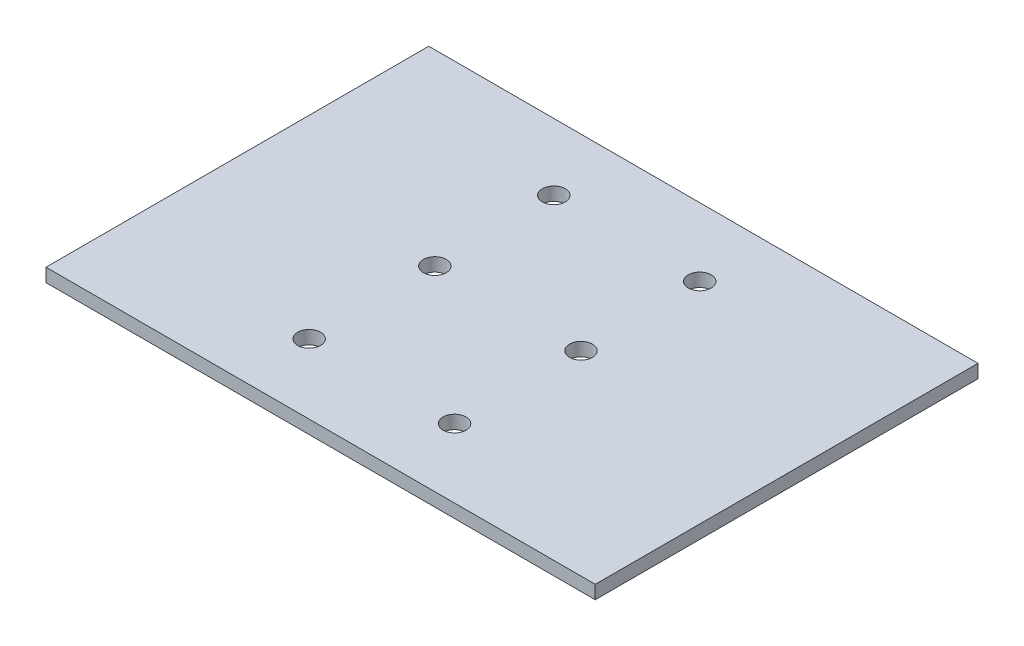
from build123d import *

# Parameters (mm, degrees)
SKETCH1_W             = 143.5
SKETCH1_H             = 100
BOSS_EXTRUDE1_DEPTH   = 3.5
F_6_0MM_DOWEL_HOLE1_D = 6
F_6_0MM_DOWEL_HOLE2_D = 6
F_6_0MM_DOWEL_HOLE3_D = 6
F_6_0MM_DOWEL_HOLE4_D = 6
F_6_0MM_DOWEL_HOLE5_D = 6
F_6_0MM_DOWEL_HOLE6_D = 6


with BuildPart() as part:
    # Sketch1 → Boss-Extrude1 (new body)
    with BuildSketch(Plane(origin=(0, 0, 0), x_dir=(1, 0, 0), z_dir=(0, 1, 0))):
        with Locations((44.896177875, -22.027268619)):
            Rectangle(SKETCH1_W, SKETCH1_H)
    extrude(amount=BOSS_EXTRUDE1_DEPTH)

    # Ø6.0mm Dowel Hole1 (through all)
    with Locations(Plane(origin=(237.217905301, 3.5, -102.05218535), x_dir=(0, 0, 1), z_dir=(0, 1, 0))):
        with Locations((156.087532559, -175.318700205)):
            Hole(F_6_0MM_DOWEL_HOLE1_D / 2)

    # Ø6.0mm Dowel Hole2 (through all)
    with Locations(Plane(origin=(237.217905301, 3.5, -102.05218535), x_dir=(0, 0, 1), z_dir=(0, 1, 0))):
        with Locations((123.097877986, -175.280990501)):
            Hole(F_6_0MM_DOWEL_HOLE2_D / 2)

    # Ø6.0mm Dowel Hole3 (through all)
    with Locations(Plane(origin=(237.217905301, 3.5, -102.05218535), x_dir=(0, 0, 1), z_dir=(0, 1, 0))):
        with Locations((123.026211567, -213.535463753)):
            Hole(F_6_0MM_DOWEL_HOLE3_D / 2)

    # Ø6.0mm Dowel Hole4 (through all)
    with Locations(Plane(origin=(237.217905301, 3.5, -102.05218535), x_dir=(0, 0, 1), z_dir=(0, 1, 0))):
        with Locations((155.91154644, -213.495641578)):
            Hole(F_6_0MM_DOWEL_HOLE4_D / 2)

    # Ø6.0mm Dowel Hole5 (through all)
    with Locations(Plane(origin=(237.217905301, 3.5, -102.05218535), x_dir=(0, 0, 1), z_dir=(0, 1, 0))):
        with Locations((91.479185985, -213.996610116)):
            Hole(F_6_0MM_DOWEL_HOLE5_D / 2)

    # Ø6.0mm Dowel Hole6 (through all)
    with Locations(Plane(origin=(237.217905301, 3.5, -102.05218535), x_dir=(0, 0, 1), z_dir=(0, 1, 0))):
        with Locations((91.901828901, -175.454462016)):
            Hole(F_6_0MM_DOWEL_HOLE6_D / 2)


solid = part.part
